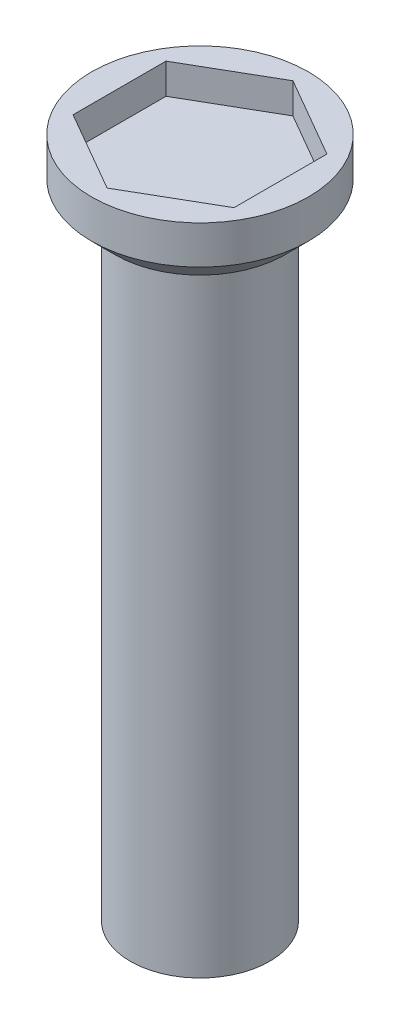
from build123d import *

# Parameters (mm, degrees)
SKETCH1_R      = 2.25
LENGTH_DEPTH   = 20
SKETCH2_R      = 3.5
CAP_DEPTH      = 2
CHAMFER_2_SIZE = 0.762
HEX_2_DEPTH    = 0.984


with BuildPart() as part:
    # Sketch1 → Length (new body)
    with BuildSketch(Plane(origin=(0, 0, 0), x_dir=(1, 0, 0), z_dir=(0, 1, 0))):
        with Locations(Location((0, 0, 0), (0, 0, 270))):
            Circle(SKETCH1_R)
    extrude(amount=LENGTH_DEPTH)

    # Sketch2 → Cap (add)
    with BuildSketch(Plane(origin=(0, 20, 0), x_dir=(1, 0, 0), z_dir=(0, 1, 0))):
        with Locations(Location((0, 0, 0), (0, 0, 270))):
            Circle(SKETCH2_R)
    extrude(amount=CAP_DEPTH)

    # Chamfer 2
    chamfer_2_edges = [part.edges().sort_by_distance(p)[0] for p in [
        (0, 20, -3.5),
    ]]
    chamfer(chamfer_2_edges, length=CHAMFER_2_SIZE)

    # Sketch3 → Hex 2 (cut)
    with BuildSketch(Plane(origin=(0, 22, 0), x_dir=(1, 0, 0), z_dir=(0, 1, 0))):
        Polygon((0, 3), (-2.598076211, 1.5), (-2.598076211, -1.5), (0, -3), (2.598076211, -1.5), (2.598076211, 1.5), align=None)
    extrude(amount=-HEX_2_DEPTH, mode=Mode.SUBTRACT)


solid = part.part
